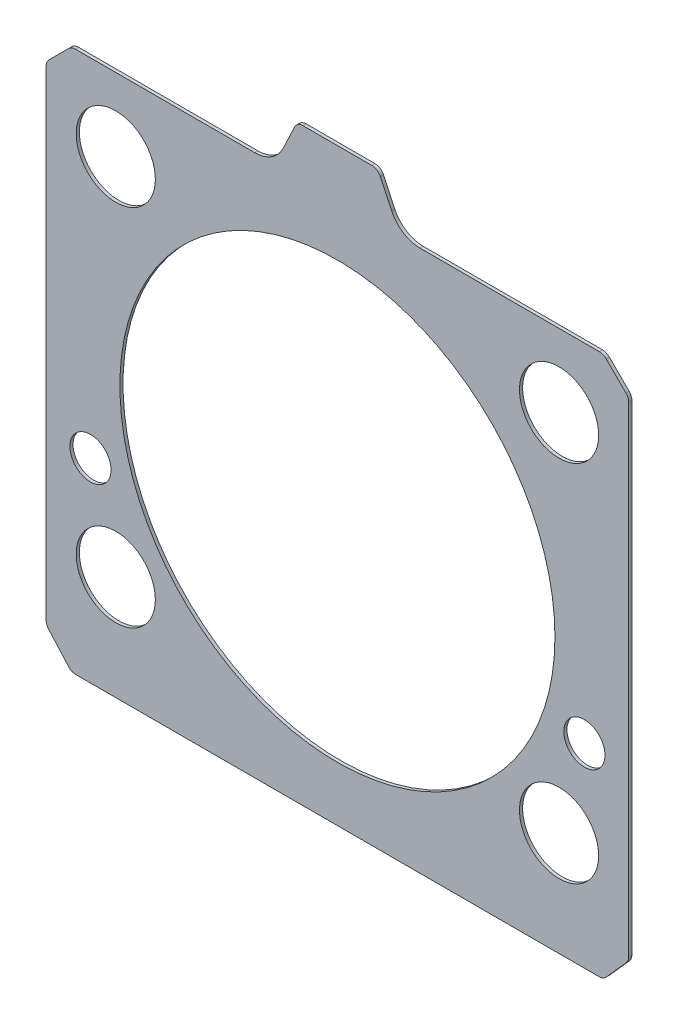
from build123d import *

# Parameters (mm, degrees)
SKETCH1_R      = 6.5
SKETCH1_R_2    = 68.7
SKETCH1_R_3    = 12.5
EXTRUDE1_DEPTH = 1
FILLET1_R      = 10
FILLET2_R      = 3


with BuildPart() as part:
    # Sketch1 → Extrude1 (new body)
    with BuildSketch(Plane.XY):
        Polygon((84, 85), (92, 77), (92, -77), (84, -86), (-84, -86), (-92, -77), (-92, 77), (-84, 85), (-19.8, 85), (-12.75, 100), (12.75, 100), (19.8, 85), align=None)
        with Locations(Location((-78, -24.5, 0), (0, 0, 180))):
            Circle(SKETCH1_R, mode=Mode.SUBTRACT)
        Circle(SKETCH1_R_2, mode=Mode.SUBTRACT)
        with Locations((-70, 62)):
            Circle(SKETCH1_R_3, mode=Mode.SUBTRACT)
        with Locations((70, 62)):
            Circle(SKETCH1_R_3, mode=Mode.SUBTRACT)
        with Locations((-70, -53)):
            Circle(SKETCH1_R_3, mode=Mode.SUBTRACT)
        with Locations((70, -53)):
            Circle(SKETCH1_R_3, mode=Mode.SUBTRACT)
        with Locations((78, -24.5)):
            Circle(SKETCH1_R, mode=Mode.SUBTRACT)
    extrude(amount=EXTRUDE1_DEPTH)

    # Fillet1
    fillet1_edges = [part.edges().sort_by_distance(p)[0] for p in [
        (-19.8, 85, 0.5),
        (19.8, 85, 0.5),
    ]]
    fillet(fillet1_edges, radius=FILLET1_R)

    # Fillet2
    fillet2_edges = [part.edges().sort_by_distance(p)[0] for p in [
        (92, -77, 0.5),
        (84, -86, 0.5),
        (-84, -86, 0.5),
        (-92, -77, 0.5),
        (-92, 77, 0.5),
        (-84, 85, 0.5),
        (-12.75, 100, 0.5),
        (12.75, 100, 0.5),
        (84, 85, 0.5),
        (92, 77, 0.5),
    ]]
    fillet(fillet2_edges, radius=FILLET2_R)


solid = part.part
